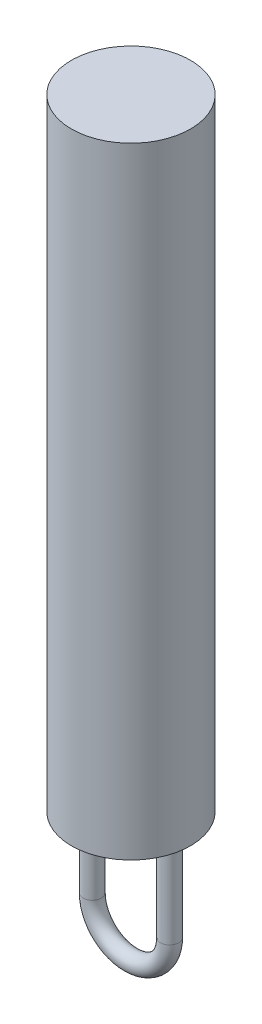
from build123d import *

# Parameters (mm, degrees)
SKETCH1_R           = 12.7
BOSS_EXTRUDE1_DEPTH = 132.4
SKETCH2_R           = 1.95


with BuildPart() as part:
    # Sketch1 → Boss-Extrude1 (new body)
    with BuildSketch(Plane(origin=(0, 0, 0), x_dir=(1, 0, 0), z_dir=(0, 1, 0))):
        with Locations(Location((0, 0, 0), (0, 0, 270))):
            Circle(SKETCH1_R)
    extrude(amount=BOSS_EXTRUDE1_DEPTH)

    # Sweep1: sweep along a path in Sketch3
    with BuildLine(Plane.XY) as sweep1_path:
        Line((8.25, 0), (8.25, -19.15))
        ThreePointArc((8.25, -19.15), (0, -27.4), (-8.25, -19.15))
        Line((-8.25, -19.15), (-8.25, 0))
    # Sketch2 → Sweep1 (sweep)
    with BuildSketch(Plane.XZ):
        with Locations((8.25, 0)):
            Circle(SKETCH2_R)
    sweep(path=sweep1_path.line)


solid = part.part
